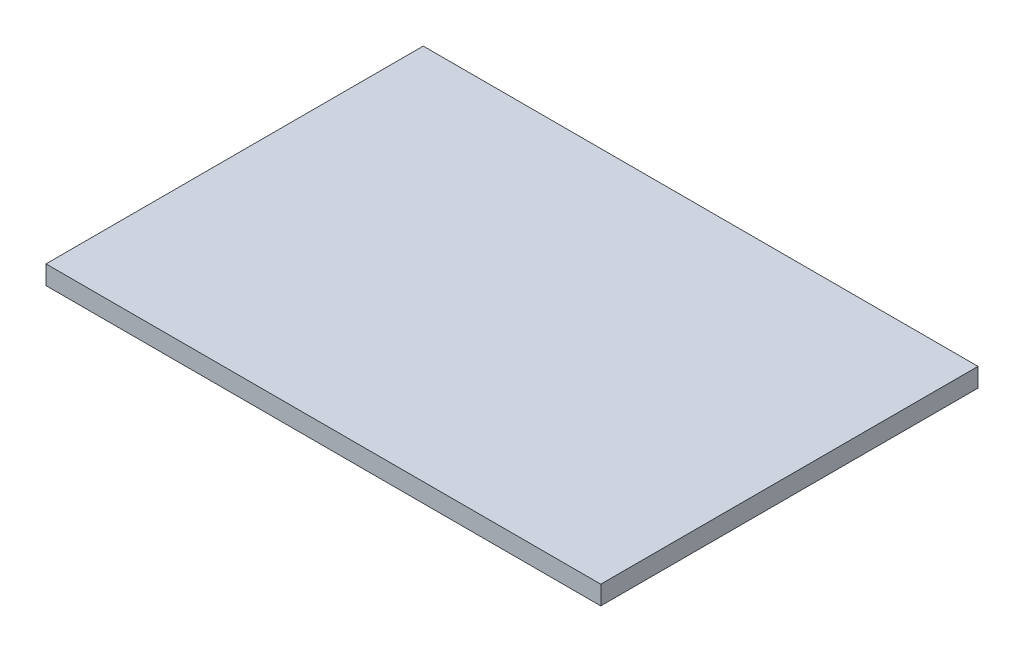
from build123d import *

# Parameters (mm, degrees)
SKETCH1_W           = 50
SKETCH1_H           = 34
BOSS_EXTRUDE1_DEPTH = 1.7
SKETCH2_W           = 13.7
SKETCH2_H           = 14
BOSS_EXTRUDE2_DEPTH = 2.2


with BuildPart() as part:
    # Sketch1 → Boss-Extrude1 (new body)
    with BuildSketch(Plane(origin=(0, 0, 0), x_dir=(1, 0, 0), z_dir=(0, 1, 0))):
        Rectangle(SKETCH1_W, SKETCH1_H)
    extrude(amount=BOSS_EXTRUDE1_DEPTH)


with BuildPart() as body_2:
    # Sketch2 → Boss-Extrude2 (new body)
    with BuildSketch(Plane.XZ):
        with Locations((14.75, -7.5)):
            Rectangle(SKETCH2_W, SKETCH2_H)
    extrude(amount=BOSS_EXTRUDE2_DEPTH)


solid = Compound([part.part, body_2.part])
